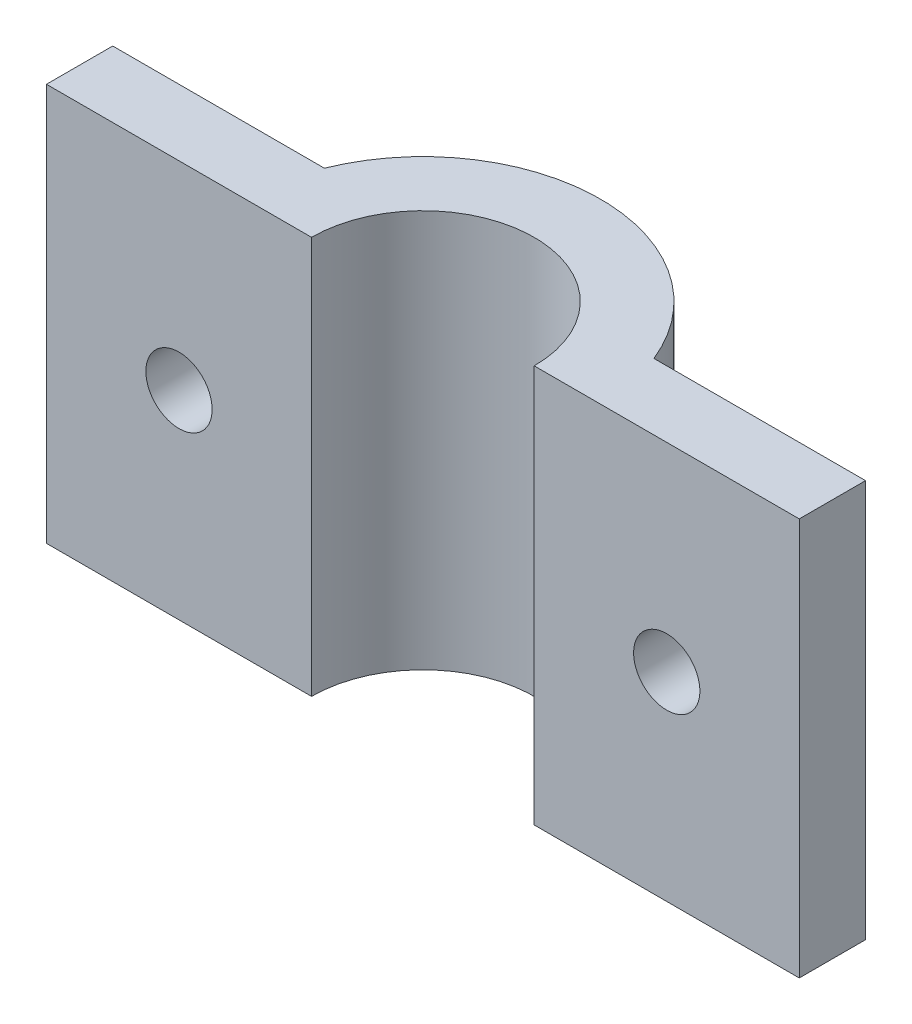
from build123d import *

# Parameters (mm, degrees)
BOSS_EXTRUDE1_DEPTH = 38.1
SKETCH2_R           = 3.175
CUT_EXTRUDE1_DEPTH  = 38.1
SKETCH3_R           = 3.175
CUT_EXTRUDE2_DEPTH  = 62.234548418


with BuildPart() as part:
    # Sketch1 → Boss-Extrude1 (new body)
    with BuildSketch(Plane(origin=(0, 0, 0), x_dir=(1, 0, 0), z_dir=(0, 1, 0))):
        with BuildLine():
            Line((0, 0), (-25.4, 0))
            Line((-25.4, 0), (-25.4, 6.35))
            Line((-25.4, 6.35), (-5.120914592, 6.35))
            ThreePointArc((-5.120914592, 6.35), (10.668, 17.018), (26.456914592, 6.35))
            Line((26.456914592, 6.35), (46.736, 6.35))
            Line((46.736, 6.35), (46.736, 0))
            Line((46.736, 0), (21.336, 0))
            ThreePointArc((21.336, 0), (10.668, 10.668), (0, 0))
        make_face()
    extrude(amount=BOSS_EXTRUDE1_DEPTH)

    # Sketch2 → Cut-Extrude1 (cut)
    with BuildSketch(Plane(origin=(0, 0, -6.35), x_dir=(-1, 0, 0), z_dir=(0, 0, -1))):
        with Locations((12.7, 19.05)):
            Circle(SKETCH2_R)
    extrude(amount=-CUT_EXTRUDE1_DEPTH, mode=Mode.SUBTRACT)

    # Sketch3 → Cut-Extrude2 (cut, through all)
    with BuildSketch(Plane(origin=(0, 0, -6.35), x_dir=(-1, 0, 0), z_dir=(0, 0, -1))):
        with Locations((-34.036, 19.05)):
            Circle(SKETCH3_R)
    extrude(amount=-CUT_EXTRUDE2_DEPTH, mode=Mode.SUBTRACT)


solid = part.part
